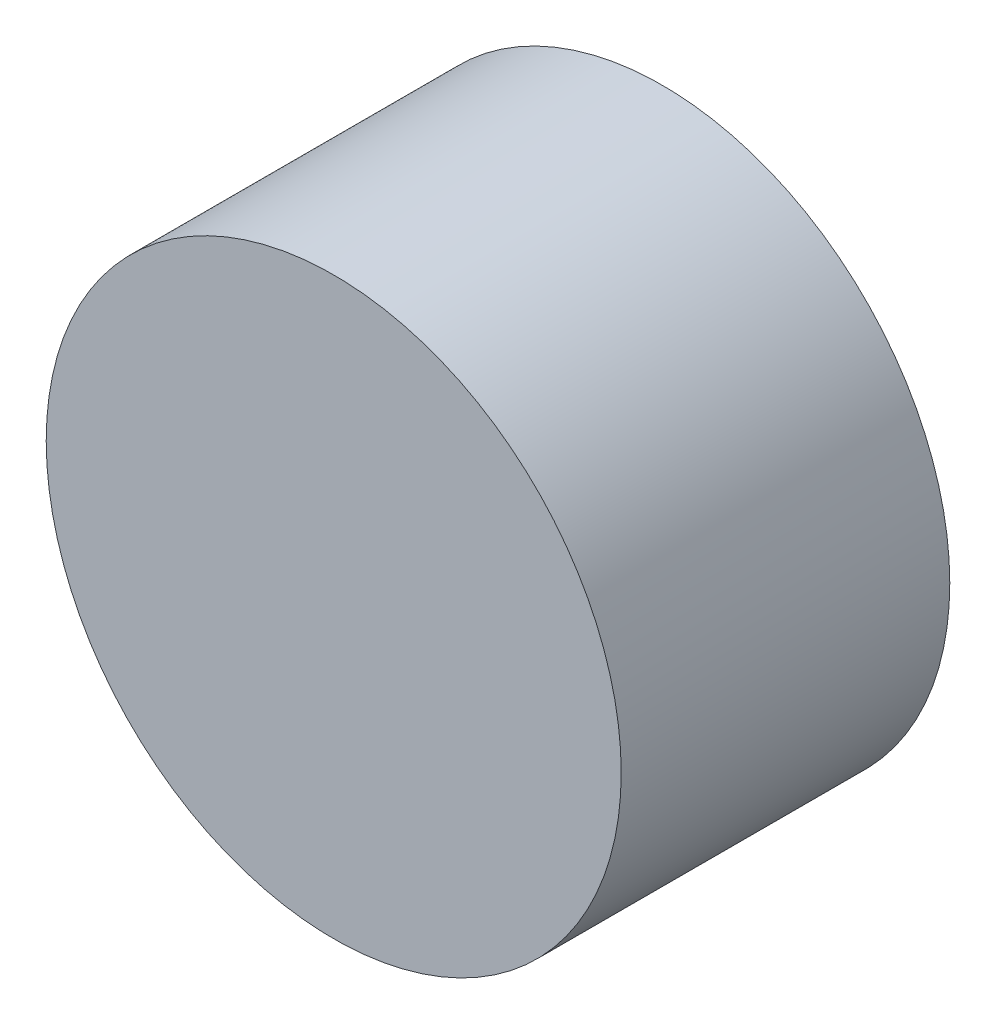
from build123d import *

# Parameters (mm, degrees)
SKETCH_1_R      = 17.5
EXTRUDE_1_DEPTH = 20


with BuildPart() as part:
    # 草图1 → 凸台-拉伸1 (new body)
    with BuildSketch(Plane.XY):
        Circle(SKETCH_1_R)
    extrude(amount=EXTRUDE_1_DEPTH)


solid = part.part
